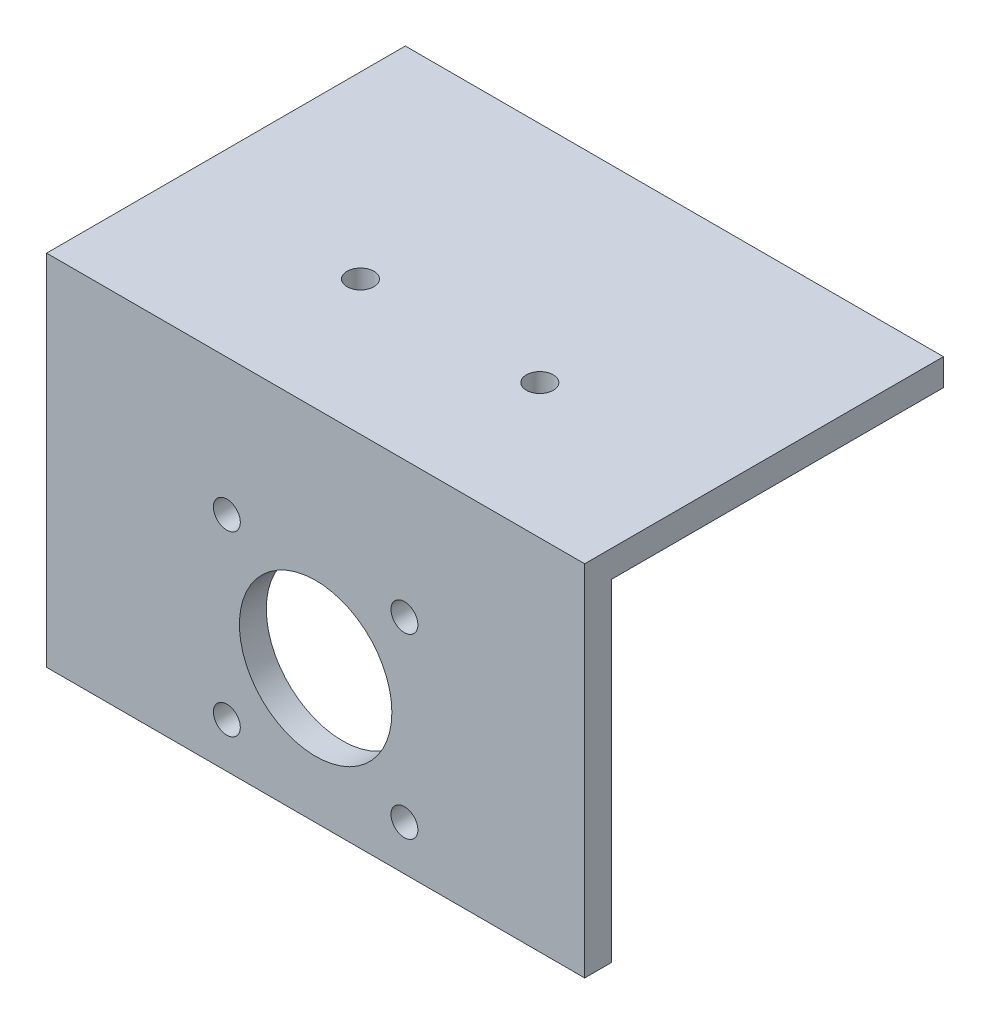
from build123d import *

# Parameters (mm, degrees)
BOSS_EXTRUDE1_DEPTH      = 30
BOSS_EXTRUDE1_DEPTH_BACK = 30
SKETCH2_R                = 1.5
SKETCH2_R_2              = 8.5
CUT_EXTRUDE1_DEPTH       = 30
SKETCH3_R                = 1.5
CUT_EXTRUDE2_DEPTH       = 30


with BuildPart() as part:
    # Sketch1 → Boss-Extrude1 (new, two sides: drawn at the far end of the back side and taken through both)
    with BuildSketch(Plane(origin=(0, 0, 0), x_dir=(0, 0, -1), z_dir=(1, 0, 0)).offset(-BOSS_EXTRUDE1_DEPTH_BACK)):
        Polygon((0, 0), (40, 0), (40, -3), (3, -3), (3, -40), (0, -40), align=None)
    extrude(amount=BOSS_EXTRUDE1_DEPTH + BOSS_EXTRUDE1_DEPTH_BACK)

    # Sketch2 → Cut-Extrude1 (cut)
    with BuildSketch(Plane.XY):
        with Locations((-9.8995, -15.201)):
            Circle(SKETCH2_R)
        with Locations((9.8995, -15.201)):
            Circle(SKETCH2_R)
        with Locations((-9.8995, -35)):
            Circle(SKETCH2_R)
        with Locations((9.8995, -35)):
            Circle(SKETCH2_R)
        with Locations((0, -25.101)):
            Circle(SKETCH2_R_2)
    extrude(amount=-CUT_EXTRUDE1_DEPTH, mode=Mode.SUBTRACT)

    # Sketch3 → Cut-Extrude2 (cut)
    with BuildSketch(Plane(origin=(0, 0, 0), x_dir=(1, 0, 0), z_dir=(0, 1, 0))):
        with Locations((-10, 15)):
            Circle(SKETCH3_R)
        with Locations((10, 15)):
            Circle(SKETCH3_R)
    extrude(amount=-CUT_EXTRUDE2_DEPTH, mode=Mode.SUBTRACT)


solid = part.part
